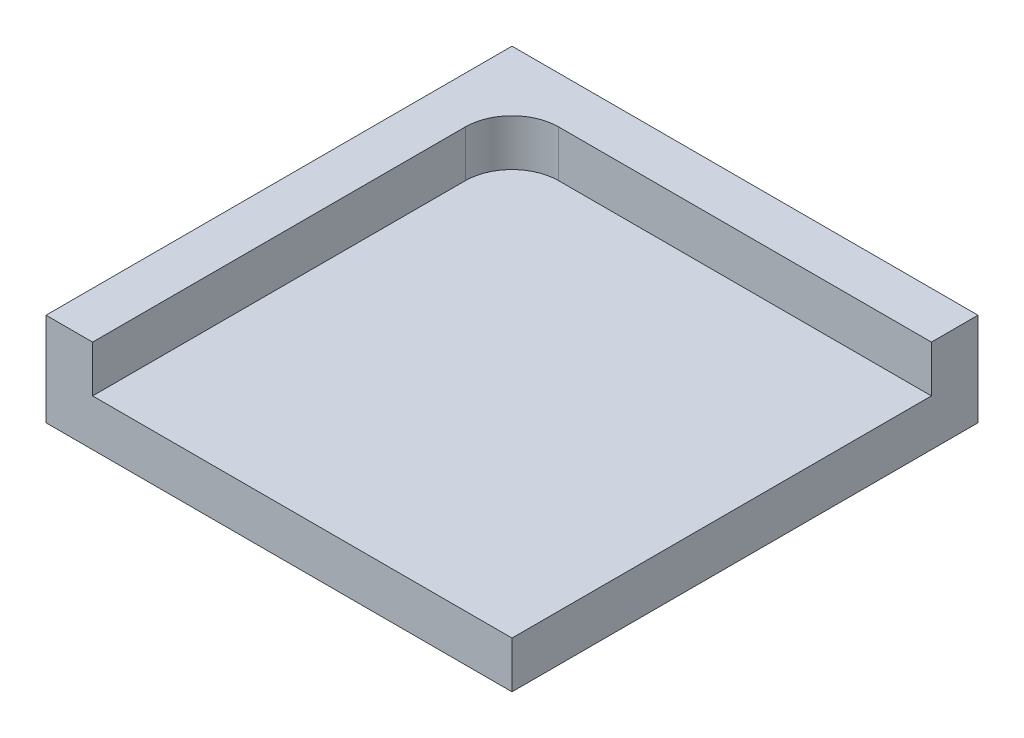
from build123d import *

# Parameters (mm, degrees)
SKETCH1_W           = 20
SKETCH1_H           = 20
BOSS_EXTRUDE2_DEPTH = 2
BOSS_EXTRUDE3_DEPTH = 2


with BuildPart() as part:
    # Sketch1 → Boss-Extrude2 (new body)
    with BuildSketch(Plane(origin=(0, 0, 0), x_dir=(1, 0, 0), z_dir=(0, 1, 0))):
        Rectangle(SKETCH1_W, SKETCH1_H)
    extrude(amount=-BOSS_EXTRUDE2_DEPTH)

    # Sketch2 → Boss-Extrude3 (add)
    with BuildSketch(Plane(origin=(0, 0, 0), x_dir=(1, 0, 0), z_dir=(0, 1, 0))):
        with BuildLine():
            Line((-6, 8), (10, 8))
            Line((10, 8), (10, 10))
            Line((10, 10), (-10, 10))
            Line((-10, 10), (-10, -10))
            Line((-10, -10), (-8, -10))
            Line((-8, -10), (-8, 6))
            ThreePointArc((-8, 6), (-7.414213562, 7.414213562), (-6, 8))
        make_face()
    extrude(amount=BOSS_EXTRUDE3_DEPTH)


solid = part.part
